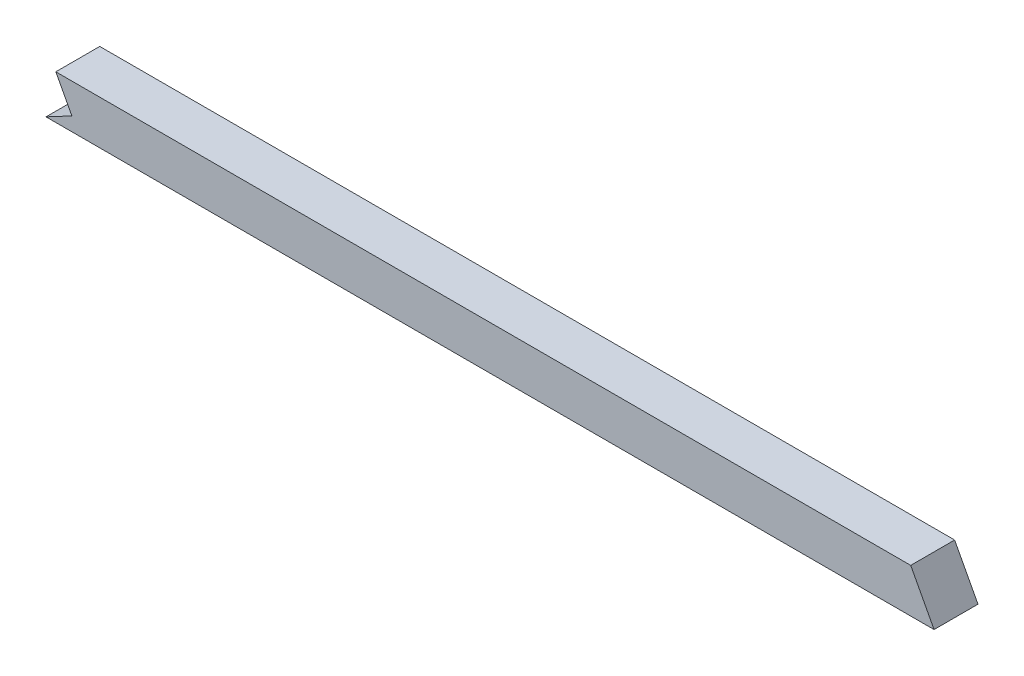
from build123d import *

# Parameters (mm, degrees)
SKETCH1_W               = 38.1
SKETCH1_H               = 38.1
BOSS_EXTRUDE1_DEPTH     = 770.128
CUT_EXTRUDE1_DEPTH      = 772.305159379
CUT_EXTRUDE2_DEPTH      = 772.305159379
CUT_EXTRUDE2_DEPTH_BACK = 772.305159379


with BuildPart() as part:
    # Sketch1 → Boss-Extrude1 (new body)
    with BuildSketch(Plane(origin=(0, 0, 0), x_dir=(0, 0, -1), z_dir=(1, 0, 0))):
        Rectangle(SKETCH1_W, SKETCH1_H)
    extrude(amount=BOSS_EXTRUDE1_DEPTH)

    # Sketch2 → Cut-Extrude1 (cut, through all)
    with BuildSketch(Plane.XY.offset(19.05)):
        Polygon((770.128, -19.05), (749.869870654, 19.05), (770.128, 19.05), align=None)
    extrude(amount=-CUT_EXTRUDE1_DEPTH, mode=Mode.SUBTRACT)

    # Sketch3 → Cut-Extrude2 (cut, two sides: drawn at the far end of the back side and taken through both)
    with BuildSketch(Plane.XY.offset(19.05).offset(-CUT_EXTRUDE2_DEPTH_BACK)):
        Polygon((0, -19.05), (22.426868859, -7.125422305), (-1.422286531, 37.728315412), (-23.84915539, 25.803737717), align=None)
    extrude(amount=CUT_EXTRUDE2_DEPTH + CUT_EXTRUDE2_DEPTH_BACK, mode=Mode.SUBTRACT)


solid = part.part
